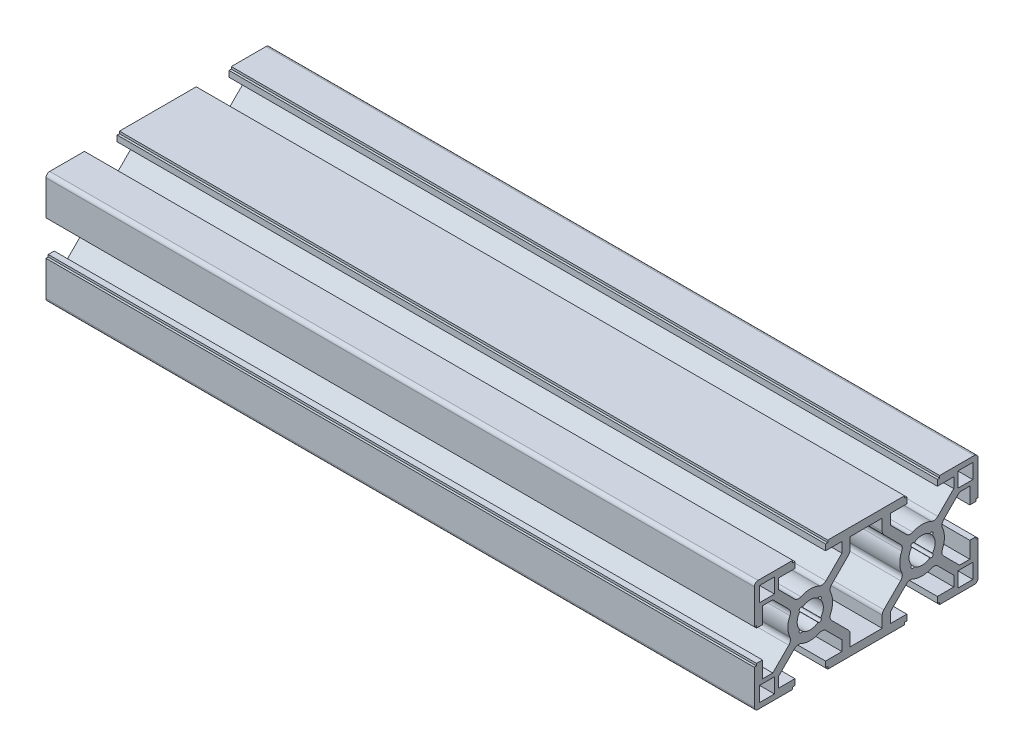
from build123d import *

# Parameters (mm, degrees)
SKETCH1_W           = 4
SKETCH1_H           = 4
BOSS_EXTRUDE1_DEPTH = 190


with BuildPart() as part:
    # Sketch1 → Boss-Extrude1 (new body)
    with BuildSketch(Plane(origin=(-190, 0, 0), x_dir=(0, -1, 0), z_dir=(-1, 0, 0))):
        with BuildLine():
            Line((-20.752252101, 10.803382818), (-25.055634919, 6.5))
            Line((-25.055634919, 6.5), (-27.8, 6.5))
            Line((-27.8, 6.5), (-27.8, 10.9))
            Line((-27.8, 10.9), (-29.4, 10.9))
            Line((-29.4, 10.9), (-29.4, 10.3))
            Line((-29.4, 10.3), (-30, 10.3))
            Line((-30, 10.3), (-30, 1))
            ThreePointArc((-30, 1), (-29.707106781, 0.292893219), (-29, 0))
            Line((-29, 0), (-19.7, 0))
            Line((-19.7, 0), (-19.7, 0.6))
            Line((-19.7, 0.6), (-19.1, 0.6))
            Line((-19.1, 0.6), (-19.1, 2.2))
            Line((-19.1, 2.2), (-23.5, 2.2))
            Line((-23.5, 2.2), (-23.5, 4.944365081))
            Line((-23.5, 4.944365081), (-19.196617182, 9.247747899))
            ThreePointArc((-19.196617182, 9.247747899), (-18.400083987, 9.66365027), (-17.508765608, 9.549670182))
            ThreePointArc((-17.508765608, 9.549670182), (-15, 9), (-12.491234392, 9.549670182))
            ThreePointArc((-12.491234392, 9.549670182), (-11.599916013, 9.66365027), (-10.803382818, 9.247747899))
            Line((-10.803382818, 9.247747899), (-6.5, 4.944365081))
            Line((-6.5, 4.944365081), (-6.5, 2.2))
            Line((-6.5, 2.2), (-10.9, 2.2))
            Line((-10.9, 2.2), (-10.9, 0.6))
            Line((-10.9, 0.6), (-10.3, 0.6))
            Line((-10.3, 0.6), (-10.3, 0))
            Line((-10.3, 0), (-1, 0))
            ThreePointArc((-1, 0), (-0.292893219, 0.292893219), (0, 1))
            Line((0, 1), (0, 10.3))
            Line((0, 10.3), (-0.6, 10.3))
            Line((-0.6, 10.3), (-0.6, 10.9))
            Line((-0.6, 10.9), (-2.2, 10.9))
            Line((-2.2, 10.9), (-2.2, 6.5))
            Line((-2.2, 6.5), (-4.944365081, 6.5))
            Line((-4.944365081, 6.5), (-9.247747899, 10.803382818))
            ThreePointArc((-9.247747899, 10.803382818), (-9.66365027, 11.599916013), (-9.549670182, 12.491234392))
            ThreePointArc((-9.549670182, 12.491234392), (-9, 15), (-9.549670182, 17.508765608))
            ThreePointArc((-9.549670182, 17.508765608), (-9.66365027, 18.400083987), (-9.247747899, 19.196617182))
            Line((-9.247747899, 19.196617182), (-4.944365081, 23.5))
            Line((-4.944365081, 23.5), (-2.2, 23.5))
            Line((-2.2, 23.5), (-2.2, 19.1))
            Line((-2.2, 19.1), (-0.6, 19.1))
            Line((-0.6, 19.1), (-0.6, 19.7))
            Line((-0.6, 19.7), (0, 19.7))
            Line((0, 19.7), (0, 40.3))
            Line((0, 40.3), (-0.6, 40.3))
            Line((-0.6, 40.3), (-0.6, 40.9))
            Line((-0.6, 40.9), (-2.2, 40.9))
            Line((-2.2, 40.9), (-2.2, 36.5))
            Line((-2.2, 36.5), (-4.944365081, 36.5))
            Line((-4.944365081, 36.5), (-9.247747899, 40.803382818))
            ThreePointArc((-9.247747899, 40.803382818), (-9.66365027, 41.599916013), (-9.549670182, 42.491234392))
            ThreePointArc((-9.549670182, 42.491234392), (-9, 45), (-9.549670182, 47.508765608))
            ThreePointArc((-9.549670182, 47.508765608), (-9.66365027, 48.400083987), (-9.247747899, 49.196617182))
            Line((-9.247747899, 49.196617182), (-4.944365081, 53.5))
            Line((-4.944365081, 53.5), (-2.2, 53.5))
            Line((-2.2, 53.5), (-2.2, 49.1))
            Line((-2.2, 49.1), (-0.6, 49.1))
            Line((-0.6, 49.1), (-0.6, 49.7))
            Line((-0.6, 49.7), (0, 49.7))
            Line((0, 49.7), (0, 59))
            ThreePointArc((0, 59), (-0.292893219, 59.707106781), (-1, 60))
            Line((-1, 60), (-10.3, 60))
            Line((-10.3, 60), (-10.3, 59.4))
            Line((-10.3, 59.4), (-10.9, 59.4))
            Line((-10.9, 59.4), (-10.9, 57.8))
            Line((-10.9, 57.8), (-6.5, 57.8))
            Line((-6.5, 57.8), (-6.5, 55.055634919))
            Line((-6.5, 55.055634919), (-10.803382818, 50.752252101))
            ThreePointArc((-10.803382818, 50.752252101), (-11.599916013, 50.33634973), (-12.491234392, 50.450329818))
            ThreePointArc((-12.491234392, 50.450329818), (-15, 51), (-17.508765608, 50.450329818))
            ThreePointArc((-17.508765608, 50.450329818), (-18.400083987, 50.33634973), (-19.196617182, 50.752252101))
            Line((-19.196617182, 50.752252101), (-23.5, 55.055634919))
            Line((-23.5, 55.055634919), (-23.5, 57.8))
            Line((-23.5, 57.8), (-19.1, 57.8))
            Line((-19.1, 57.8), (-19.1, 59.4))
            Line((-19.1, 59.4), (-19.7, 59.4))
            Line((-19.7, 59.4), (-19.7, 60))
            Line((-19.7, 60), (-29, 60))
            ThreePointArc((-29, 60), (-29.707106781, 59.707106781), (-30, 59))
            Line((-30, 59), (-30, 49.7))
            Line((-30, 49.7), (-29.4, 49.7))
            Line((-29.4, 49.7), (-29.4, 49.1))
            Line((-29.4, 49.1), (-27.8, 49.1))
            Line((-27.8, 49.1), (-27.8, 53.5))
            Line((-27.8, 53.5), (-25.055634919, 53.5))
            Line((-25.055634919, 53.5), (-20.752252101, 49.196617182))
            ThreePointArc((-20.752252101, 49.196617182), (-20.33634973, 48.400083987), (-20.450329818, 47.508765608))
            ThreePointArc((-20.450329818, 47.508765608), (-21, 45), (-20.450329818, 42.491234392))
            ThreePointArc((-20.450329818, 42.491234392), (-20.33634973, 41.599916013), (-20.752252101, 40.803382818))
            Line((-20.752252101, 40.803382818), (-25.055634919, 36.5))
            Line((-25.055634919, 36.5), (-27.8, 36.5))
            Line((-27.8, 36.5), (-27.8, 40.9))
            Line((-27.8, 40.9), (-29.4, 40.9))
            Line((-29.4, 40.9), (-29.4, 40.3))
            Line((-29.4, 40.3), (-30, 40.3))
            Line((-30, 40.3), (-30, 19.7))
            Line((-30, 19.7), (-29.4, 19.7))
            Line((-29.4, 19.7), (-29.4, 19.1))
            Line((-29.4, 19.1), (-27.8, 19.1))
            Line((-27.8, 19.1), (-27.8, 23.5))
            Line((-27.8, 23.5), (-25.055634919, 23.5))
            Line((-25.055634919, 23.5), (-20.752252101, 19.196617182))
            ThreePointArc((-20.752252101, 19.196617182), (-20.33634973, 18.400083987), (-20.450329818, 17.508765608))
            ThreePointArc((-20.450329818, 17.508765608), (-21, 15), (-20.450329818, 12.491234392))
            ThreePointArc((-20.450329818, 12.491234392), (-20.33634973, 11.599916013), (-20.752252101, 10.803382818))
        make_face()
        with Locations((-26.6, 56.6)):
            Rectangle(SKETCH1_W, SKETCH1_H, mode=Mode.SUBTRACT)
        with Locations((-3.4, 56.6)):
            Rectangle(SKETCH1_W, SKETCH1_H, mode=Mode.SUBTRACT)
        with Locations((-26.6, 3.4)):
            Rectangle(SKETCH1_W, SKETCH1_H, mode=Mode.SUBTRACT)
        with Locations((-3.4, 3.4)):
            Rectangle(SKETCH1_W, SKETCH1_H, mode=Mode.SUBTRACT)
        with BuildLine():
            Line((-10.803382818, 39.247747899), (-6.294974747, 34.739339828))
            ThreePointArc((-6.294974747, 34.739339828), (-5.808339724, 34.414180701), (-5.234314575, 34.3))
            Line((-5.234314575, 34.3), (-2.2, 34.3))
            Line((-2.2, 34.3), (-2.2, 25.7))
            Line((-2.2, 25.7), (-5.234314575, 25.7))
            ThreePointArc((-5.234314575, 25.7), (-5.808339724, 25.585819299), (-6.294974747, 25.260660172))
            Line((-6.294974747, 25.260660172), (-10.803382818, 20.752252101))
            ThreePointArc((-10.803382818, 20.752252101), (-11.599916013, 20.33634973), (-12.491234392, 20.450329818))
            ThreePointArc((-12.491234392, 20.450329818), (-15, 21), (-17.508765608, 20.450329818))
            ThreePointArc((-17.508765608, 20.450329818), (-18.400083987, 20.33634973), (-19.196617182, 20.752252101))
            Line((-19.196617182, 20.752252101), (-23.705025253, 25.260660172))
            ThreePointArc((-23.705025253, 25.260660172), (-24.191660276, 25.585819299), (-24.765685425, 25.7))
            Line((-24.765685425, 25.7), (-27.8, 25.7))
            Line((-27.8, 25.7), (-27.8, 34.3))
            Line((-27.8, 34.3), (-24.765685425, 34.3))
            ThreePointArc((-24.765685425, 34.3), (-24.191660276, 34.414180701), (-23.705025253, 34.739339828))
            Line((-23.705025253, 34.739339828), (-19.196617182, 39.247747899))
            ThreePointArc((-19.196617182, 39.247747899), (-18.400083987, 39.66365027), (-17.508765608, 39.549670182))
            ThreePointArc((-17.508765608, 39.549670182), (-15, 39), (-12.491234392, 39.549670182))
            ThreePointArc((-12.491234392, 39.549670182), (-11.599916013, 39.66365027), (-10.803382818, 39.247747899))
        make_face(mode=Mode.SUBTRACT)
        with BuildLine():
            ThreePointArc((-17.802270236, 47.096969605), (-17.828427125, 47.828427125), (-17.096969605, 47.802270236))
            ThreePointArc((-17.096969605, 47.802270236), (-15, 48.5), (-12.903030395, 47.802270236))
            ThreePointArc((-12.903030395, 47.802270236), (-12.171572875, 47.828427125), (-12.197729764, 47.096969605))
            ThreePointArc((-12.197729764, 47.096969605), (-11.5, 45), (-12.197729764, 42.903030395))
            ThreePointArc((-12.197729764, 42.903030395), (-12.171572875, 42.171572875), (-12.903030395, 42.197729764))
            ThreePointArc((-12.903030395, 42.197729764), (-15, 41.5), (-17.096969605, 42.197729764))
            ThreePointArc((-17.096969605, 42.197729764), (-17.828427125, 42.171572875), (-17.802270236, 42.903030395))
            ThreePointArc((-17.802270236, 42.903030395), (-18.5, 45), (-17.802270236, 47.096969605))
        make_face(mode=Mode.SUBTRACT)
        with BuildLine():
            ThreePointArc((-12.903030395, 12.197729764), (-15, 11.5), (-17.096969605, 12.197729764))
            ThreePointArc((-17.096969605, 12.197729764), (-17.828427125, 12.171572875), (-17.802270236, 12.903030395))
            ThreePointArc((-17.802270236, 12.903030395), (-18.5, 15), (-17.802270236, 17.096969605))
            ThreePointArc((-17.802270236, 17.096969605), (-17.828427125, 17.828427125), (-17.096969605, 17.802270236))
            ThreePointArc((-17.096969605, 17.802270236), (-15, 18.5), (-12.903030395, 17.802270236))
            ThreePointArc((-12.903030395, 17.802270236), (-12.171572875, 17.828427125), (-12.197729764, 17.096969605))
            ThreePointArc((-12.197729764, 17.096969605), (-11.5, 15), (-12.197729764, 12.903030395))
            ThreePointArc((-12.197729764, 12.903030395), (-12.171572875, 12.171572875), (-12.903030395, 12.197729764))
        make_face(mode=Mode.SUBTRACT)
    extrude(amount=-BOSS_EXTRUDE1_DEPTH)


solid = part.part
